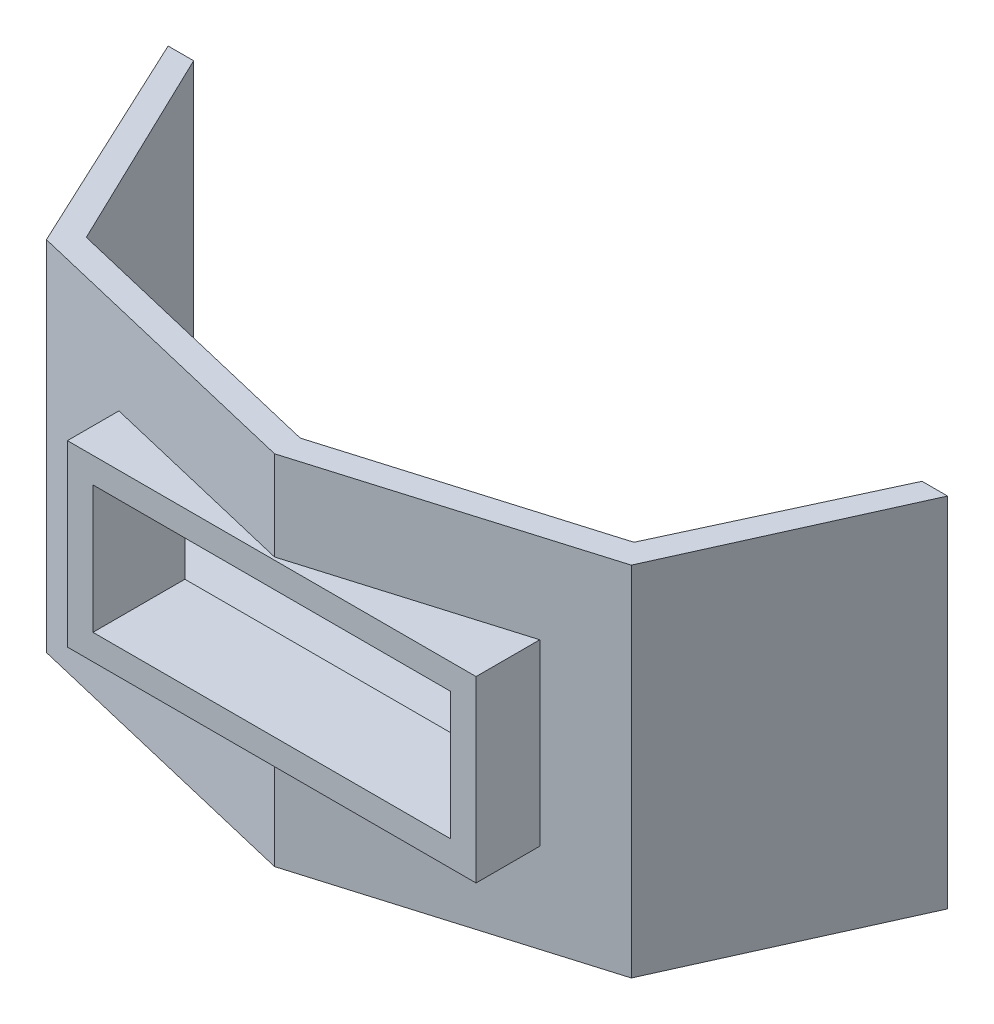
from build123d import *

# Parameters (mm, degrees)
BOSS_EXTRUDE1_DEPTH = 70
CUT_EXTRUDE1_DEPTH  = 65
SKETCH5_W           = 80
SKETCH5_H           = 35
BOSS_EXTRUDE2_DEPTH = 18
SKETCH6_W           = 70
SKETCH6_H           = 25
CUT_EXTRUDE2_DEPTH  = 18


with BuildPart() as part:
    # Sketch1 → Boss-Extrude1 (new body)
    with BuildSketch(Plane(origin=(0, 0, 0), x_dir=(1, 0, 0), z_dir=(0, 1, 0))):
        Polygon((-55.37403033, -102.482648945), (3.252686078, -116.449526131), (57.060212297, -100.408827863), (76.3, -57.735026919), (-76.3, -57.735026919), align=None)
    extrude(amount=BOSS_EXTRUDE1_DEPTH)

    # Sketch4 → Cut-Extrude1 (cut)
    with BuildSketch(Plane(origin=(0, 70, 0), x_dir=(1, 0, 0), z_dir=(0, 1, 0))):
        Polygon((-51.867290581, -98.178143042), (3.108154981, -111.275163368), (53.44146669, -96.270172009), (71.3, -57.735026919), (-71.3, -57.735026919), align=None)
    extrude(amount=-CUT_EXTRUDE1_DEPTH, mode=Mode.SUBTRACT)

    # Sketch5 → Boss-Extrude2 (add)
    with BuildSketch(Plane.XY.offset(117)):
        with Locations((3.252686078, 35)):
            Rectangle(SKETCH5_W, SKETCH5_H)
    extrude(amount=-BOSS_EXTRUDE2_DEPTH)

    # Sketch6 → Cut-Extrude2 (cut)
    with BuildSketch(Plane.XY.offset(117)):
        with Locations((3.252686078, 35)):
            Rectangle(SKETCH6_W, SKETCH6_H)
    extrude(amount=-CUT_EXTRUDE2_DEPTH, mode=Mode.SUBTRACT)


solid = part.part
